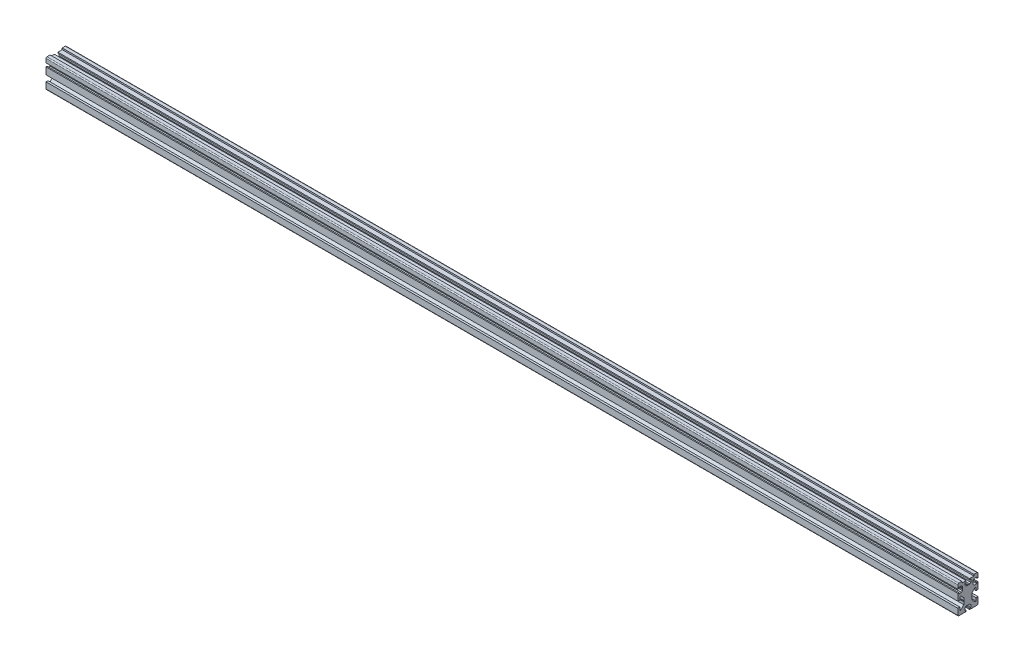
from build123d import *

# Parameters (mm, degrees)
BOSS_EXTRUDE1_DEPTH = 901


with BuildPart() as part:
    # Sketch1 → Boss-Extrude1 (new body)
    with BuildSketch(Plane(origin=(24, 0, 0), x_dir=(0, 0, -1), z_dir=(1, 0, 0))):
        with BuildLine():
            Line((-5.3, 9.35), (-5.3, 8.019615242))
            Line((-5.3, 8.019615242), (-5, 7.5))
            Line((-5, 7.5), (-5.3, 6.980384758))
            Line((-5.3, 6.980384758), (-5.3, 5.65))
            Line((-5.3, 5.65), (-6.3, 4.65))
            Line((-6.3, 4.65), (-8.9, 4.65))
            Line((-8.9, 4.65), (-8.9, 5.8))
            Line((-8.9, 5.8), (-10, 5.8))
            Line((-10, 5.8), (-10, -1))
            Line((-10, -1), (-8, -1))
            Line((-8, -1), (-8, 2))
            Line((-8, 2), (-7, 2))
            Line((-7, 2), (-4, -1))
            Line((-4, -1), (-4, -3.480384758))
            Line((-4, -3.480384758), (-3.7, -4))
            Line((-3.7, -4), (-4, -4.519615242))
            Line((-4, -4.519615242), (-4, -7))
            Line((-4, -7), (-7, -10))
            Line((-7, -10), (-8, -10))
            Line((-8, -10), (-8, -7))
            Line((-8, -7), (-10, -7))
            Line((-10, -7), (-10, -13))
            ThreePointArc((-10, -13), (-9.707106781, -13.707106781), (-9, -14))
            Line((-9, -14), (-1.7, -14))
            Line((-1.7, -14), (-1.7, -12.9))
            Line((-1.7, -12.9), (-2.85, -12.9))
            Line((-2.85, -12.9), (-2.85, -10.3))
            Line((-2.85, -10.3), (-1.85, -9.3))
            Line((-1.85, -9.3), (-0.519615242, -9.3))
            Line((-0.519615242, -9.3), (0, -9))
            Line((0, -9), (0.519615242, -9.3))
            Line((0.519615242, -9.3), (1.85, -9.3))
            Line((1.85, -9.3), (2.85, -10.3))
            Line((2.85, -10.3), (2.85, -12.9))
            Line((2.85, -12.9), (1.7, -12.9))
            Line((1.7, -12.9), (1.7, -14))
            Line((1.7, -14), (9, -14))
            ThreePointArc((9, -14), (9.707106781, -13.707106781), (10, -13))
            Line((10, -13), (10, -7))
            Line((10, -7), (8, -7))
            Line((8, -7), (8, -10))
            Line((8, -10), (7, -10))
            Line((7, -10), (4, -7))
            Line((4, -7), (4, -4.519615242))
            Line((4, -4.519615242), (3.7, -4))
            Line((3.7, -4), (4, -3.480384758))
            Line((4, -3.480384758), (4, -1))
            Line((4, -1), (7, 2))
            Line((7, 2), (8, 2))
            Line((8, 2), (8, -1))
            Line((8, -1), (10, -1))
            Line((10, -1), (10, 5.8))
            Line((10, 5.8), (8.9, 5.8))
            Line((8.9, 5.8), (8.9, 4.65))
            Line((8.9, 4.65), (6.3, 4.65))
            Line((6.3, 4.65), (5.3, 5.65))
            Line((5.3, 5.65), (5.3, 6.980384758))
            Line((5.3, 6.980384758), (5, 7.5))
            Line((5, 7.5), (5.3, 8.019615242))
            Line((5.3, 8.019615242), (5.3, 9.35))
            Line((5.3, 9.35), (6.3, 10.35))
            Line((6.3, 10.35), (8.9, 10.35))
            Line((8.9, 10.35), (8.9, 9.2))
            Line((8.9, 9.2), (10, 9.2))
            Line((10, 9.2), (10, 13))
            ThreePointArc((10, 13), (9.707106781, 13.707106781), (9, 14))
            Line((9, 14), (6, 14))
            Line((6, 14), (6, 12.5))
            Line((6, 12.5), (1.7, 12.5))
            Line((1.7, 12.5), (1.7, 11.4))
            Line((1.7, 11.4), (2.85, 11.4))
            Line((2.85, 11.4), (2.85, 8.8))
            Line((2.85, 8.8), (1.85, 7.8))
            Line((1.85, 7.8), (0.519615242, 7.8))
            Line((0.519615242, 7.8), (0, 7.5))
            Line((0, 7.5), (-0.519615242, 7.8))
            Line((-0.519615242, 7.8), (-1.85, 7.8))
            Line((-1.85, 7.8), (-2.85, 8.8))
            Line((-2.85, 8.8), (-2.85, 11.4))
            Line((-2.85, 11.4), (-1.7, 11.4))
            Line((-1.7, 11.4), (-1.7, 12.5))
            Line((-1.7, 12.5), (-6, 12.5))
            Line((-6, 12.5), (-6, 14))
            Line((-6, 14), (-9, 14))
            ThreePointArc((-9, 14), (-9.707106781, 13.707106781), (-10, 13))
            Line((-10, 13), (-10, 9.2))
            Line((-10, 9.2), (-8.9, 9.2))
            Line((-8.9, 9.2), (-8.9, 10.35))
            Line((-8.9, 10.35), (-6.3, 10.35))
            Line((-6.3, 10.35), (-5.3, 9.35))
        make_face()
    extrude(amount=BOSS_EXTRUDE1_DEPTH)


solid = part.part
